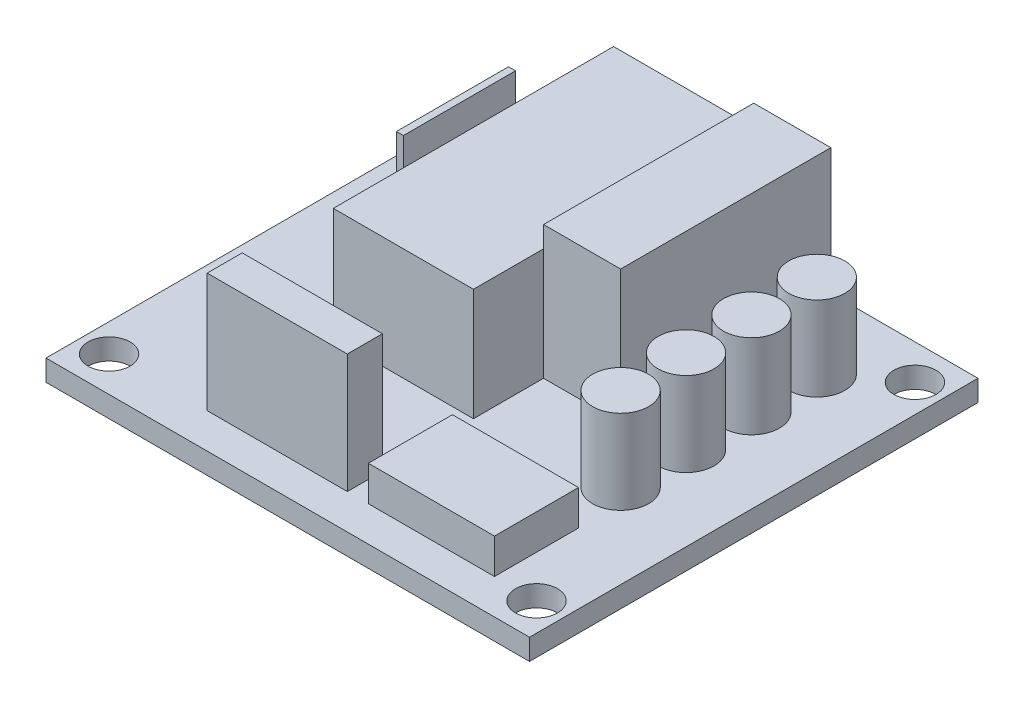
from build123d import *

# Parameters (mm, degrees)
SKETCH_1_W      = 34.5
SKETCH_1_H      = 32
SKETCH_1_R      = 1.5
EXTRUDE_1_DEPTH = 1.5
SKETCH_1_3_R    = 2
EXTRUDE_2_DEPTH = 6
SKETCH_1_4_W    = 9
SKETCH_1_4_H    = 6
EXTRUDE_3_DEPTH = 2.5
SKETCH_1_5_W    = 10
SKETCH_1_5_H    = 2.5
EXTRUDE_4_DEPTH = 8.5
SKETCH_1_6_W    = 5.5
SKETCH_1_6_H    = 15
EXTRUDE_5_DEPTH = 9.5
EXTRUDE_6_DEPTH = 8
SKETCH_1_9_W    = 0.5
SKETCH_1_9_H    = 8
EXTRUDE_7_DEPTH = 8
SKETCH_1_10_W   = 2.5
SKETCH_1_10_H   = 10
SKETCH_1_10_W_2 = 0.5
SKETCH_1_10_H_2 = 8
EXTRUDE_8_DEPTH = 2.5


with BuildPart() as part:
    # Эскиз1 → Бобышка-Вытянуть1 (new body)
    with BuildSketch(Plane(origin=(0, 0, 0), x_dir=(1, 0, 0), z_dir=(0, 1, 0))):
        Rectangle(SKETCH_1_W, SKETCH_1_H)
        with Locations((-15.25, -13.5)):
            Circle(SKETCH_1_R, mode=Mode.SUBTRACT)
        with Locations((15.25, -13.5)):
            Circle(SKETCH_1_R, mode=Mode.SUBTRACT)
        with Locations((-15.25, 13.5)):
            Circle(SKETCH_1_R, mode=Mode.SUBTRACT)
        with Locations((15.25, 13.5)):
            Circle(SKETCH_1_R, mode=Mode.SUBTRACT)
    extrude(amount=-EXTRUDE_1_DEPTH)

    # Эскиз1<3> → Бобышка-Вытянуть2 (add)
    with BuildSketch(Plane(origin=(0, 0, 0), x_dir=(1, 0, 0), z_dir=(0, 1, 0))):
        with Locations((11.25, 10.5)):
            Circle(SKETCH_1_3_R)
        with Locations((11.25, 5.833333333)):
            Circle(SKETCH_1_3_R)
        with Locations((11.25, 1.166666667)):
            Circle(SKETCH_1_3_R)
        with Locations((11.25, -3.5)):
            Circle(SKETCH_1_3_R)
    extrude(amount=EXTRUDE_2_DEPTH)

    # Эскиз1<4> → Бобышка-Вытянуть3 (add)
    with BuildSketch(Plane(origin=(0, 0, 0), x_dir=(1, 0, 0), z_dir=(0, 1, 0))):
        with Locations((7.75, -10.5)):
            Rectangle(SKETCH_1_4_W, SKETCH_1_4_H)
    extrude(amount=EXTRUDE_3_DEPTH)

    # Эскиз1<5> → Бобышка-Вытянуть4 (add)
    with BuildSketch(Plane(origin=(0, 0, 0), x_dir=(1, 0, 0), z_dir=(0, 1, 0))):
        with Locations((-3.25, -12.25)):
            Rectangle(SKETCH_1_5_W, SKETCH_1_5_H)
    extrude(amount=EXTRUDE_4_DEPTH)

    # Эскиз1<6> → Бобышка-Вытянуть5 (add)
    with BuildSketch(Plane(origin=(0, 0, 0), x_dir=(1, 0, 0), z_dir=(0, 1, 0))):
        with Locations((4.5, 8)):
            Rectangle(SKETCH_1_6_W, SKETCH_1_6_H)
    extrude(amount=EXTRUDE_5_DEPTH)

    # Эскиз1<7> → Бобышка-Вытянуть6 (add)
    with BuildSketch(Plane(origin=(0, 0, 0), x_dir=(1, 0, 0), z_dir=(0, 1, 0))):
        Polygon((1.75, 15.5), (-8.25, 15.5), (-8.25, -4.5), (1.75, -4.5), (1.75, 0.5), align=None)
    extrude(amount=EXTRUDE_6_DEPTH)

    # Эскиз1<9> → Бобышка-Вытянуть7 (add)
    with BuildSketch(Plane(origin=(0, 0, 0), x_dir=(1, 0, 0), z_dir=(0, 1, 0))):
        with Locations((-10.5, 6.5)):
            Rectangle(SKETCH_1_9_W, SKETCH_1_9_H)
    extrude(amount=EXTRUDE_7_DEPTH)

    # Эскиз1<10> → Бобышка-Вытянуть8 (add)
    with BuildSketch(Plane(origin=(0, 0, 0), x_dir=(1, 0, 0), z_dir=(0, 1, 0))):
        with Locations((-10.5, 6.5)):
            Rectangle(SKETCH_1_10_W, SKETCH_1_10_H)
        with Locations((-10.5, 6.5)):
            Rectangle(SKETCH_1_10_W_2, SKETCH_1_10_H_2, mode=Mode.SUBTRACT)
    extrude(amount=EXTRUDE_8_DEPTH)


solid = part.part
